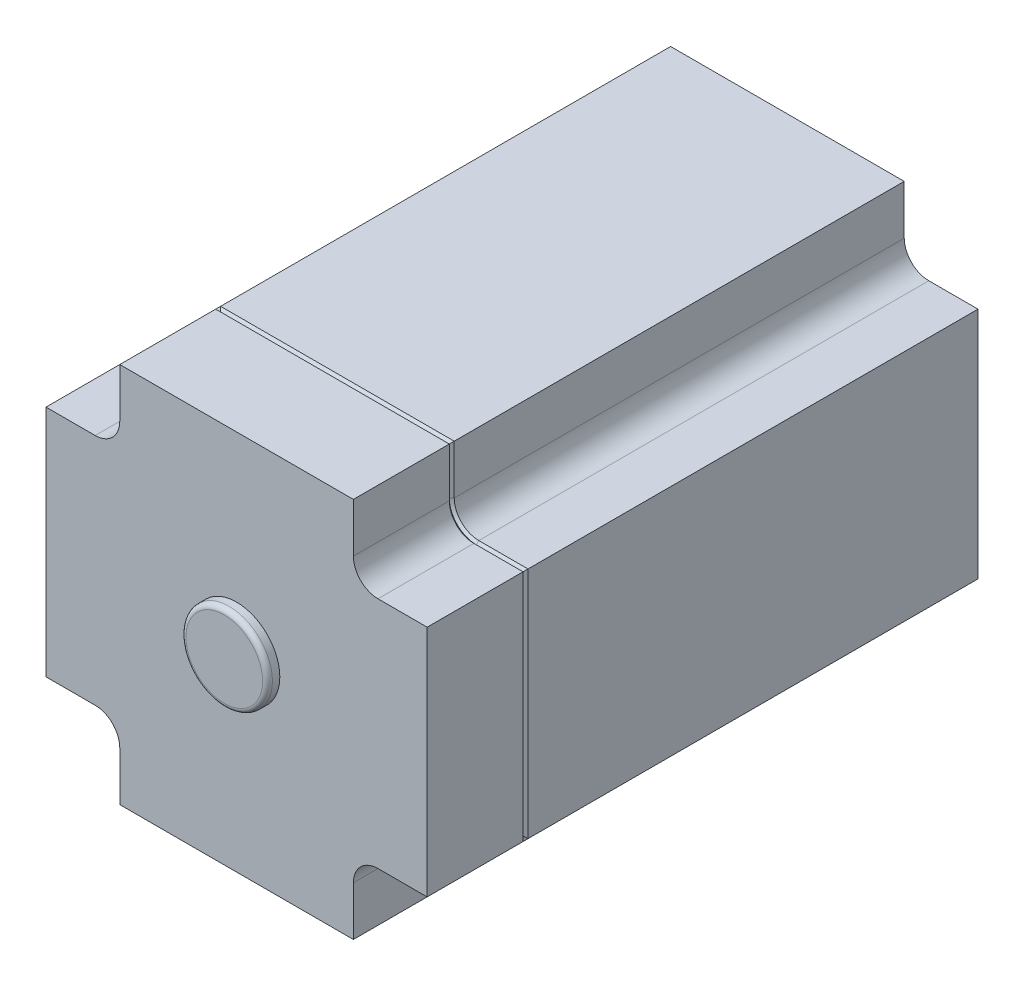
from build123d import *

# Parameters (mm, degrees)
Y_KSEKLIK_EKSTR_ZYON1_DEPTH     = 13
Y_KSEKLIK_EKSTR_ZYON2_DEPTH     = 224
KES_EKSTR_ZYON1_DEPTH           = 1
KES_EKSTR_ZYON1_TAPER           = 45
KES_EKSTR_ZYON1_OTHER_WAY_DEPTH = 1
KES_EKSTR_ZYON1_OTHER_WAY_TAPER = 45
IZIM8_R                         = 17.581787387
Y_KSEKLIK_EKSTR_ZYON3_DEPTH     = 5
RADYUS2_R                       = 2


with BuildPart() as part:
    # Çizim1 → Yükseklik-Ekstrüzyon1 (new body)
    with BuildSketch(Plane.XY):
        Polygon((-58.626768768, 58.968306861), (-84.598484816, 33.394607486), (-84.598484816, -15.059977091), (-58.626768768, -41.031693139), (-10.172184191, -41.031693139), (15.401515184, -15.059977091), (15.401515184, 32.642615461), (-10.924176216, 58.968306861), align=None)
    extrude(amount=Y_KSEKLIK_EKSTR_ZYON1_DEPTH)

    # Çizim2 → Yükseklik-Ekstrüzyon2 (add)
    with BuildSketch(Plane.XY):
        with BuildLine():
            Line((47.5, 57.5), (47.5, 77.5))
            Line((47.5, 77.5), (-47.5, 77.5))
            Line((-47.5, 77.5), (-47.5, 57.5))
            ThreePointArc((-47.5, 57.5), (-50.428932188, 50.428932188), (-57.5, 47.5))
            Line((-57.5, 47.5), (-77.5, 47.5))
            Line((-77.5, 47.5), (-77.5, -47.5))
            Line((-77.5, -47.5), (-57.5, -47.5))
            ThreePointArc((-57.5, -47.5), (-50.428932188, -50.428932188), (-47.5, -57.5))
            Line((-47.5, -57.5), (-47.5, -77.5))
            Line((-47.5, -77.5), (47.5, -77.5))
            Line((47.5, -77.5), (47.5, -57.5))
            ThreePointArc((47.5, -57.5), (50.428932188, -50.428932188), (57.5, -47.5))
            Line((57.5, -47.5), (77.5, -47.5))
            Line((77.5, -47.5), (77.5, 47.5))
            Line((77.5, 47.5), (57.5, 47.5))
            ThreePointArc((57.5, 47.5), (50.428932188, 50.428932188), (47.5, 57.5))
        make_face()
    extrude(amount=Y_KSEKLIK_EKSTR_ZYON2_DEPTH)

    # Çizim7 → Kes-Ekstrüzyon1 (cut)
    with BuildSketch(Plane.XY.offset(184)):
        with BuildLine():
            Line((57.5, -56.5), (86.5, -56.5))
            Line((86.5, -56.5), (86.5, 56.5))
            Line((86.5, 56.5), (57.5, 56.5))
            ThreePointArc((57.5, 56.5), (56.792893219, 56.792893219), (56.5, 57.5))
            Line((56.5, 57.5), (56.5, 86.5))
            Line((56.5, 86.5), (-56.5, 86.5))
            Line((-56.5, 86.5), (-56.5, 57.5))
            ThreePointArc((-56.5, 57.5), (-56.792893219, 56.792893219), (-57.5, 56.5))
            Line((-57.5, 56.5), (-86.5, 56.5))
            Line((-86.5, 56.5), (-86.5, -56.5))
            Line((-86.5, -56.5), (-57.5, -56.5))
            ThreePointArc((-57.5, -56.5), (-56.792893219, -56.792893219), (-56.5, -57.5))
            Line((-56.5, -57.5), (-56.5, -86.5))
            Line((-56.5, -86.5), (56.5, -86.5))
            Line((56.5, -86.5), (56.5, -57.5))
            ThreePointArc((56.5, -57.5), (56.792893219, -56.792893219), (57.5, -56.5))
        make_face()
        with BuildLine():
            Line((-46.5, -76.5), (46.5, -76.5))
            Line((46.5, -76.5), (46.5, -57.5))
            ThreePointArc((46.5, -57.5), (49.721825407, -49.721825407), (57.5, -46.5))
            Line((57.5, -46.5), (76.5, -46.5))
            Line((76.5, -46.5), (76.5, 46.5))
            Line((76.5, 46.5), (57.5, 46.5))
            ThreePointArc((57.5, 46.5), (49.721825407, 49.721825407), (46.5, 57.5))
            Line((46.5, 57.5), (46.5, 76.5))
            Line((46.5, 76.5), (-46.5, 76.5))
            Line((-46.5, 76.5), (-46.5, 57.5))
            ThreePointArc((-46.5, 57.5), (-49.721825407, 49.721825407), (-57.5, 46.5))
            Line((-57.5, 46.5), (-76.5, 46.5))
            Line((-76.5, 46.5), (-76.5, -46.5))
            Line((-76.5, -46.5), (-57.5, -46.5))
            ThreePointArc((-57.5, -46.5), (-49.721825407, -49.721825407), (-46.5, -57.5))
            Line((-46.5, -57.5), (-46.5, -76.5))
        make_face(mode=Mode.SUBTRACT)
    extrude(amount=-KES_EKSTR_ZYON1_DEPTH, taper=KES_EKSTR_ZYON1_TAPER, mode=Mode.SUBTRACT)

    # Çizim7 → Kes-Ekstrüzyon1 other way (cut)
    with BuildSketch(Plane.XY.offset(184)):
        with BuildLine():
            Line((57.5, -56.5), (86.5, -56.5))
            Line((86.5, -56.5), (86.5, 56.5))
            Line((86.5, 56.5), (57.5, 56.5))
            ThreePointArc((57.5, 56.5), (56.792893219, 56.792893219), (56.5, 57.5))
            Line((56.5, 57.5), (56.5, 86.5))
            Line((56.5, 86.5), (-56.5, 86.5))
            Line((-56.5, 86.5), (-56.5, 57.5))
            ThreePointArc((-56.5, 57.5), (-56.792893219, 56.792893219), (-57.5, 56.5))
            Line((-57.5, 56.5), (-86.5, 56.5))
            Line((-86.5, 56.5), (-86.5, -56.5))
            Line((-86.5, -56.5), (-57.5, -56.5))
            ThreePointArc((-57.5, -56.5), (-56.792893219, -56.792893219), (-56.5, -57.5))
            Line((-56.5, -57.5), (-56.5, -86.5))
            Line((-56.5, -86.5), (56.5, -86.5))
            Line((56.5, -86.5), (56.5, -57.5))
            ThreePointArc((56.5, -57.5), (56.792893219, -56.792893219), (57.5, -56.5))
        make_face()
        with BuildLine():
            Line((-46.5, -76.5), (46.5, -76.5))
            Line((46.5, -76.5), (46.5, -57.5))
            ThreePointArc((46.5, -57.5), (49.721825407, -49.721825407), (57.5, -46.5))
            Line((57.5, -46.5), (76.5, -46.5))
            Line((76.5, -46.5), (76.5, 46.5))
            Line((76.5, 46.5), (57.5, 46.5))
            ThreePointArc((57.5, 46.5), (49.721825407, 49.721825407), (46.5, 57.5))
            Line((46.5, 57.5), (46.5, 76.5))
            Line((46.5, 76.5), (-46.5, 76.5))
            Line((-46.5, 76.5), (-46.5, 57.5))
            ThreePointArc((-46.5, 57.5), (-49.721825407, 49.721825407), (-57.5, 46.5))
            Line((-57.5, 46.5), (-76.5, 46.5))
            Line((-76.5, 46.5), (-76.5, -46.5))
            Line((-76.5, -46.5), (-57.5, -46.5))
            ThreePointArc((-57.5, -46.5), (-49.721825407, -49.721825407), (-46.5, -57.5))
            Line((-46.5, -57.5), (-46.5, -76.5))
        make_face(mode=Mode.SUBTRACT)
    extrude(amount=KES_EKSTR_ZYON1_OTHER_WAY_DEPTH, taper=KES_EKSTR_ZYON1_OTHER_WAY_TAPER, mode=Mode.SUBTRACT)

    # Çizim8 → Yükseklik-Ekstrüzyon3 (add)
    with BuildSketch(Plane.XY.offset(224)):
        Circle(IZIM8_R)
    extrude(amount=Y_KSEKLIK_EKSTR_ZYON3_DEPTH)

    # Radyus2
    radyus2_edges = [part.edges().sort_by_distance(p)[0] for p in [
        (-17.581787387, 0, 229),
    ]]
    fillet(radyus2_edges, radius=RADYUS2_R)


solid = part.part
